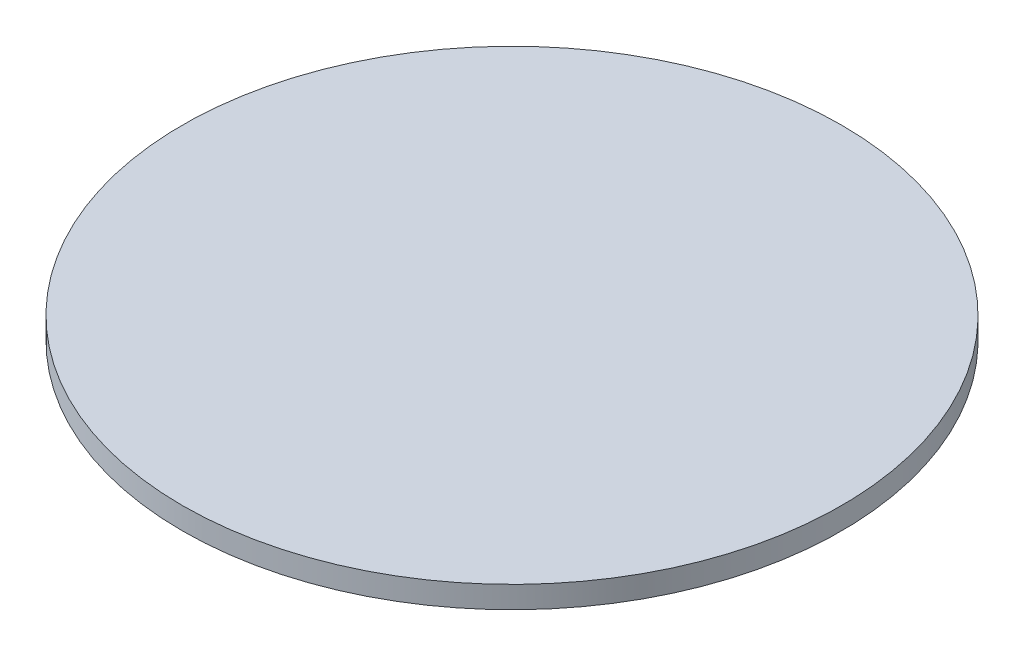
from build123d import *

# Parameters (mm, degrees)
CROQUIS1_R              = 15
SALIENTE_EXTRUIR1_DEPTH = 1


with BuildPart() as part:
    # Croquis1 → Saliente-Extruir1 (new body)
    with BuildSketch(Plane(origin=(0, 0, 0), x_dir=(1, 0, 0), z_dir=(0, 1, 0))):
        with Locations(Location((0, 0, 0), (0, 0, 270))):
            Circle(CROQUIS1_R)
    extrude(amount=SALIENTE_EXTRUIR1_DEPTH)


solid = part.part
